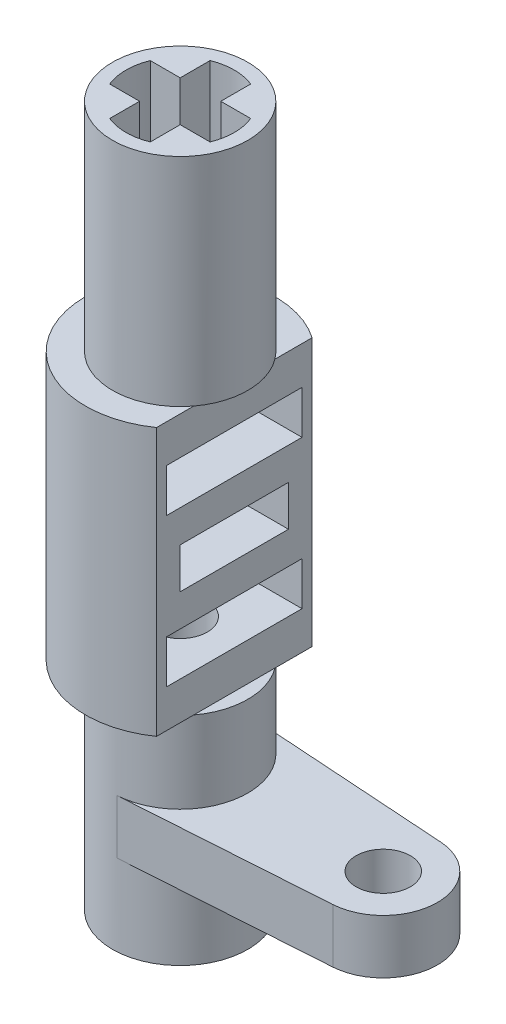
from build123d import *

# Parameters (mm, degrees)
SKETCH_1_R                = 2.5
EXTRUDE_1_DEPTH           = 25.88
EXTRUDE_START             = 3
SKETCH_2_R                = 1
EXTRUDE_2_DEPTH           = 2
CUT_EXTRUDE_1_DEPTH       = 4
CUT_EXTRUDE_START         = 21.88
CUT_EXTRUDE_2_DEPTH       = 4
SKETCH_6_R                = 0.25
CUT_EXTRUDE_3_DEPTH       = 0.25
CUT_EXTRUDE_START_2       = 4.25
SKETCH_7_R                = 0.25
CUT_EXTRUDE_4_DEPTH       = 0.25
EXTRUDE_START_2           = 8
SKETCH_17_R               = 3.5
EXTRUDE_5_DEPTH           = 9.88
SKETCH_18_R               = 1
CUT_EXTRUDE_11_DEPTH      = 10
CUT_EXTRUDE_START_3       = 15.88
SKETCH_19_R               = 1
CUT_EXTRUDE_12_DEPTH      = 10
CUT_EXTRUDE_13_DEPTH      = 2.5
CUT_EXTRUDE_13_DEPTH_BACK = 2.5
SKETCH_20_W               = 4
SKETCH_20_H               = 1.6
CUT_EXTRUDE_14_DEPTH      = 28.789825476
CUT_EXTRUDE_14_DEPTH_BACK = 28.789825476
SKETCH_21_W               = 1.5
SKETCH_21_H               = 9.88
SKETCH_22_W               = 4
SKETCH_22_H               = 1.5
CUT_EXTRUDE_15_DEPTH      = 28.789825476


with BuildPart() as part:
    # 草图1 → 凸台-拉伸1 (new body)
    with BuildSketch(Plane(origin=(0, 0, 0), x_dir=(1, 0, 0), z_dir=(0, 1, 0))):
        with Locations(Location((0, 0, 0), (0, 0, 270))):
            Circle(SKETCH_1_R)
    extrude(amount=EXTRUDE_1_DEPTH)

    # 草图2 → 凸台-拉伸2 (add)
    with BuildSketch(Plane(origin=(0, 0, 0), x_dir=(1, 0, 0), z_dir=(0, 1, 0)).offset(EXTRUDE_START)):
        with BuildLine():
            Line((0.166666667, 2.494438258), (7.633333333, 1.995550606))
            ThreePointArc((7.633333333, 1.995550606), (9.5, 0), (7.633333333, -1.995550606))
            Line((7.633333333, -1.995550606), (0.166666667, -2.494438258))
            ThreePointArc((0.166666667, -2.494438258), (-2.5, 0), (0.166666667, 2.494438258))
        make_face()
        with Locations(Location((7.5, 0, 0), (0, 0, 270))):
            Circle(SKETCH_2_R, mode=Mode.SUBTRACT)
    extrude(amount=EXTRUDE_2_DEPTH)

    # 草图3 → 切除-拉伸1 (cut)
    with BuildSketch(Plane(origin=(0, 0, 0), x_dir=(1, 0, 0), z_dir=(0, 1, 0))):
        with BuildLine():
            Line((-1.854049622, -0.75), (-0.75, -0.75))
            Line((-0.75, -0.75), (-0.75, -1.854049622))
            ThreePointArc((-0.75, -1.854049622), (0, -2), (0.75, -1.854049622))
            Line((0.75, -1.854049622), (0.75, -0.75))
            Line((0.75, -0.75), (1.854049622, -0.75))
            ThreePointArc((1.854049622, -0.75), (2, 0), (1.854049622, 0.75))
            Line((1.854049622, 0.75), (0.75, 0.75))
            Line((0.75, 0.75), (0.75, 1.854049622))
            ThreePointArc((0.75, 1.854049622), (0, 2), (-0.75, 1.854049622))
            Line((-0.75, 1.854049622), (-0.75, 0.75))
            Line((-0.75, 0.75), (-1.854049622, 0.75))
            ThreePointArc((-1.854049622, 0.75), (-2, 0), (-1.854049622, -0.75))
        make_face()
    extrude(amount=CUT_EXTRUDE_1_DEPTH, mode=Mode.SUBTRACT)

    # 草图5 → 切除-拉伸2 (cut)
    with BuildSketch(Plane(origin=(0, 0, 0), x_dir=(1, 0, 0), z_dir=(0, 1, 0)).offset(CUT_EXTRUDE_START)):
        with BuildLine():
            Line((1.854049622, 0.75), (0.75, 0.75))
            Line((0.75, 0.75), (0.75, 1.854049622))
            ThreePointArc((0.75, 1.854049622), (0, 2), (-0.75, 1.854049622))
            Line((-0.75, 1.854049622), (-0.75, 0.75))
            Line((-0.75, 0.75), (-1.854049622, 0.75))
            ThreePointArc((-1.854049622, 0.75), (-2, 0), (-1.854049622, -0.75))
            Line((-1.854049622, -0.75), (-0.75, -0.75))
            Line((-0.75, -0.75), (-0.75, -1.854049622))
            ThreePointArc((-0.75, -1.854049622), (0, -2), (0.75, -1.854049622))
            Line((0.75, -1.854049622), (0.75, -0.75))
            Line((0.75, -0.75), (1.854049622, -0.75))
            ThreePointArc((1.854049622, -0.75), (2, 0), (1.854049622, 0.75))
        make_face()
    extrude(amount=CUT_EXTRUDE_2_DEPTH, mode=Mode.SUBTRACT)

    # 草图6 → 切除-拉伸3 (cut)
    with BuildSketch(Plane(origin=(0, 0, 0), x_dir=(1, 0, 0), z_dir=(0, 1, 0)).offset(CUT_EXTRUDE_START)):
        with Locations(Location((0.75, 0, 0), (0, 0, 270))):
            Circle(SKETCH_6_R)
    extrude(amount=-CUT_EXTRUDE_3_DEPTH, mode=Mode.SUBTRACT)

    # 草图7 → 切除-拉伸4 (cut)
    with BuildSketch(Plane(origin=(0, 0, 0), x_dir=(1, 0, 0), z_dir=(0, 1, 0)).offset(CUT_EXTRUDE_START_2)):
        with Locations(Location((0.75, 0, 0), (0, 0, 270))):
            Circle(SKETCH_7_R)
    extrude(amount=-CUT_EXTRUDE_4_DEPTH, mode=Mode.SUBTRACT)

    # 草图17 → 凸台-拉伸5 (add)
    with BuildSketch(Plane(origin=(0, 0, 0), x_dir=(1, 0, 0), z_dir=(0, 1, 0)).offset(EXTRUDE_START_2)):
        with Locations(Location((0, 0, 0), (0, 0, 270))):
            Circle(SKETCH_17_R)
    extrude(amount=EXTRUDE_5_DEPTH)

    # 草图18 → 切除-拉伸11 (cut)
    with BuildSketch(Plane(origin=(0, 0, 0), x_dir=(1, 0, 0), z_dir=(0, 1, 0))):
        with Locations(Location((0, 0, 0), (0, 0, 270))):
            Circle(SKETCH_18_R)
    extrude(amount=CUT_EXTRUDE_11_DEPTH, mode=Mode.SUBTRACT)

    # 草图19 → 切除-拉伸12 (cut)
    with BuildSketch(Plane(origin=(0, 0, 0), x_dir=(1, 0, 0), z_dir=(0, 1, 0)).offset(CUT_EXTRUDE_START_3)):
        with Locations(Location((0, 0, 0), (0, 0, 270))):
            Circle(SKETCH_19_R)
    extrude(amount=CUT_EXTRUDE_12_DEPTH, mode=Mode.SUBTRACT)

    # 草图20 → 切除-拉伸13 (cut, two sides: drawn at the far end of the back side and taken through both)
    with BuildSketch(Plane.XY.offset(-CUT_EXTRUDE_13_DEPTH_BACK)):
        with Locations((0, 15.68)):
            Rectangle(SKETCH_20_W, SKETCH_20_H)
        with Locations((0, 10.2)):
            Rectangle(SKETCH_20_W, SKETCH_20_H)
    extrude(amount=CUT_EXTRUDE_13_DEPTH + CUT_EXTRUDE_13_DEPTH_BACK, mode=Mode.SUBTRACT)

    # 草图21 → 切除-拉伸14 (cut, two sides: drawn at the far end of the back side and taken through both)
    with BuildSketch(Plane.XY.offset(-CUT_EXTRUDE_14_DEPTH_BACK)):
        with Locations((2.75, 12.94)):
            Rectangle(SKETCH_21_W, SKETCH_21_H)
    extrude(amount=CUT_EXTRUDE_14_DEPTH + CUT_EXTRUDE_14_DEPTH_BACK, mode=Mode.SUBTRACT)

    # 草图22 → 切除-拉伸15 (cut, through all)
    with BuildSketch(Plane(origin=(0, 0, 0), x_dir=(0, 0, -1), z_dir=(1, 0, 0))):
        with Locations((0, 12.94)):
            Rectangle(SKETCH_22_W, SKETCH_22_H)
    extrude(amount=CUT_EXTRUDE_15_DEPTH, mode=Mode.SUBTRACT)


solid = part.part
